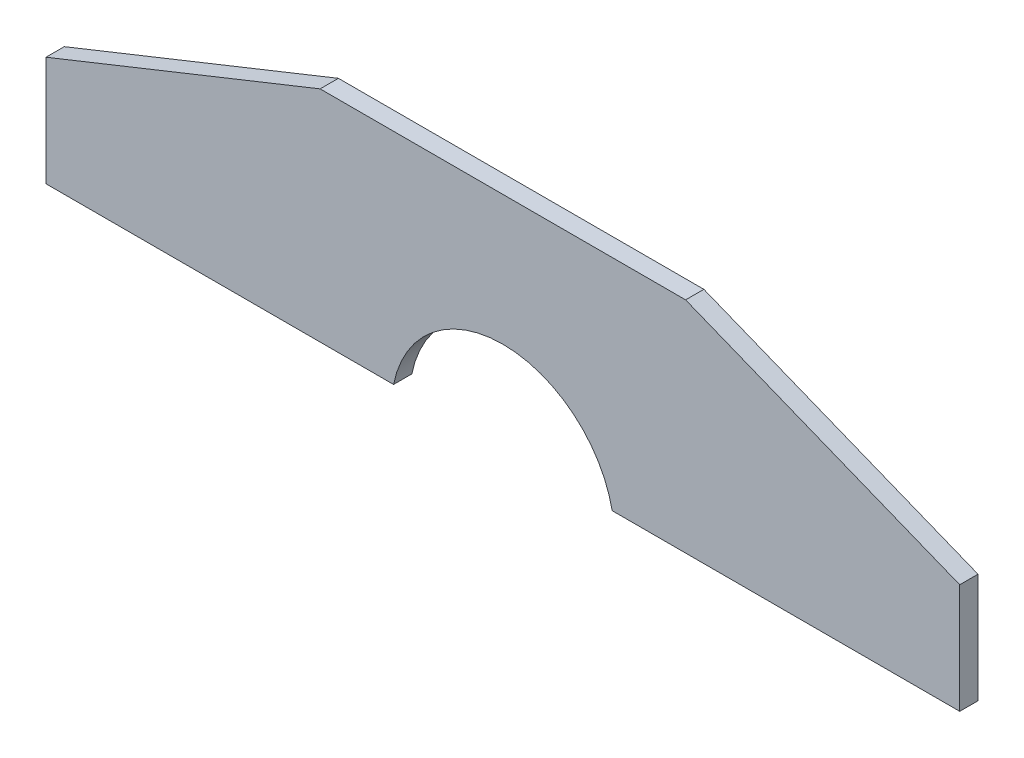
from build123d import *

# Parameters (mm, degrees)
BOSS_EXTRUDE1_DEPTH = 5


with BuildPart() as part:
    # Sketch1 → Boss-Extrude1 (new body)
    with BuildSketch(Plane.XY):
        with BuildLine():
            Line((-125, 36), (-50, 66))
            Line((-50, 66), (50, 66))
            Line((50, 66), (125, 36))
            Line((125, 36), (125, 6))
            Line((125, 6), (29.904013109, 6))
            ThreePointArc((29.904013109, 6), (0, 30.5), (-29.904013109, 6))
            Line((-29.904013109, 6), (-125, 6))
            Line((-125, 6), (-125, 36))
        make_face()
    extrude(amount=BOSS_EXTRUDE1_DEPTH)


solid = part.part
